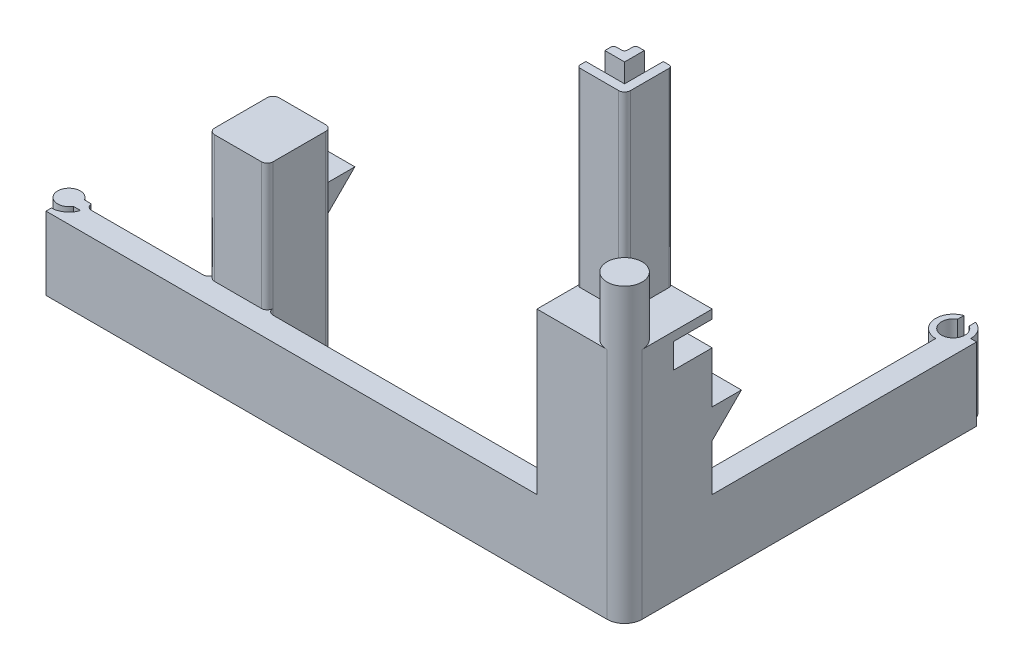
from build123d import *
from build123d.topology import SkipClean

# Parameters (mm, degrees)
SKETCH1_W                 = 30
SKETCH1_H                 = 30
BOSS_EXTRUDE1_DEPTH       = 80
SKETCH2_R                 = 6
BOSS_EXTRUDE2_DEPTH       = 20
CUT_EXTRUDE1_DEPTH        = 83.764726786
BOSS_EXTRUDE3_DEPTH       = 65
BOSS_EXTRUDE5_DEPTH       = 2
BOSS_EXTRUDE6_DEPTH       = 23
BOSS_EXTRUDE7_DEPTH       = 25
FILLET1_R                 = 2
SKETCH11_R                = 6.055782361
CUT_EXTRUDE2_DEPTH        = 2.125
CUT_EXTRUDE3_DEPTH        = 273.546239196
CUT_EXTRUDE3_DEPTH_BACK   = 273.546239196
SKETCH12_W                = 13.25
SKETCH12_H                = 8.5
FILLET2_R                 = 2
CUT_EXTRUDE4_REACH        = 233.991
SKETCH15_W                = 3.75
SKETCH15_H                = 3.75
FILLET3_R                 = 1
BOSS_EXTRUDE8_REACH       = 263.62
SKETCH16_W                = 20
SKETCH16_H                = 22
FILLET4_R                 = 2
FILLET5_R                 = 2
SKETCH17_W                = 15
SKETCH17_H                = 17
CUT_EXTRUDE5_DEPTH        = 66
CHAMFER1_SIZE             = 7
BOSS_EXTRUDE9_DEPTH       = 30
BOSS_EXTRUDE10_DEPTH      = 7.999995
BOSS_EXTRUDE10_DEPTH_BACK = 8.000005


with BuildPart() as part:
    # Sketch1 → Boss-Extrude1 (new body)
    with BuildSketch(Plane(origin=(0, 0, 0), x_dir=(1, 0, 0), z_dir=(0, 1, 0))):
        Rectangle(SKETCH1_W, SKETCH1_H)
    extrude(amount=BOSS_EXTRUDE1_DEPTH)

    # Sketch2 → Boss-Extrude2 (add)
    with BuildSketch(Plane(origin=(0, 80, 0), x_dir=(1, 0, 0), z_dir=(0, 1, 0))):
        with Locations(Location((9, -9, 0), (0, 0, 270))):
            Circle(SKETCH2_R)
    extrude(amount=BOSS_EXTRUDE2_DEPTH)

    # Sketch3 → Cut-Extrude1 (cut, through all)
    with BuildSketch(Plane(origin=(0, 80, 0), x_dir=(1, 0, 0), z_dir=(0, 1, 0))):
        with BuildLine():
            Line((9, -15), (15, -15))
            Line((15, -15), (15, -9))
            ThreePointArc((15, -9), (13.242640687, -13.242640687), (9, -15))
        make_face()
    extrude(amount=-CUT_EXTRUDE1_DEPTH, mode=Mode.SUBTRACT)

    # Sketch4 → Boss-Extrude3 (add)
    with BuildSketch(Plane(origin=(0, 80, 0), x_dir=(1, 0, 0), z_dir=(0, 1, 0))):
        Polygon((1.25, 11.25), (1.25, 15), (-1.75, 15), (-1.75, 11.25), (-1.75, 1.75), (-11.25, 1.75), (-15, 1.75), (-15, -1.25), (-11.25, -1.25), (1.25, -1.25), align=None)
        Polygon((-8.25, 11.25), (-8.25, 8.25), (-11.25, 8.25), (-15, 8.25), (-15, 11.25), (-11.25, 11.25), (-11.25, 15), (-8.25, 15), align=None)
    extrude(amount=BOSS_EXTRUDE3_DEPTH)

    # Sketch6 → Boss-Extrude5 (add)
    with BuildSketch(Plane.XZ):
        with BuildLine():
            Line((15, -15), (7, -15))
            Line((7, -15), (7, -99.5))
            ThreePointArc((7, -99.5), (2.757359313, -109.742640687), (13, -105.5))
            Line((13, -105.5), (15, -105.5))
            Line((15, -105.5), (15, -15))
        make_face()
    extrude(amount=-BOSS_EXTRUDE5_DEPTH)

    # Sketch7 → Boss-Extrude6 (add)
    with SkipClean():  # the faces are left unmerged after this step: merging them gives an invalid solid
        with BuildSketch(Plane(origin=(0, 2, 0), x_dir=(1, 0, 0), z_dir=(0, 1, 0))):
            with BuildLine():
                Line((9, 111.156854249), (9, 108.964101615))
                ThreePointArc((9, 108.964101615), (7, 101.5), (5, 108.964101615))
                Line((5, 108.964101615), (5, 111.156854249))
                ThreePointArc((5, 111.156854249), (1.086408642, 104.485388128), (7, 99.5))
                Line((7, 99.5), (7, 15))
                Line((7, 15), (15, 15))
                Line((15, 15), (15, 105.5))
                Line((15, 105.5), (13, 105.5))
                ThreePointArc((13, 105.5), (11.898979486, 108.964101615), (9, 111.156854249))
            make_face()
        extrude(amount=BOSS_EXTRUDE6_DEPTH)

    # Sketch9 → Boss-Extrude7 (add)
    with SkipClean():  # the faces are left unmerged after this step: merging them gives an invalid solid
        with BuildSketch(Plane.XZ):
            with BuildLine():
                Line((-15, 15), (-15, 7))
                Line((-15, 7), (-177.175, 7))
                ThreePointArc((-177.175, 7), (-177.252697751, 6.037536458), (-177.48377869, 5.1))
                Line((-177.48377869, 5.1), (-179.797778509, 5.1))
                ThreePointArc((-179.797778509, 5.1), (-187.05, 7), (-179.797778509, 8.9))
                Line((-179.797778509, 8.9), (-177.3, 8.9))
                ThreePointArc((-177.3, 8.9), (-179.491885554, 11.955834237), (-183.050001601, 13.173329766))
                Line((-183.050001601, 13.173329766), (-183.050001601, 15))
                Line((-183.050001601, 15), (-15, 15))
            make_face()
        extrude(amount=-BOSS_EXTRUDE7_DEPTH)

    # Fillet1
    fillet1_edges = [part.edges().sort_by_distance(p)[0] for p in [
        (-177.175, 12.5, 7),
    ]]
    fillet(fillet1_edges, radius=FILLET1_R)

    # Sketch11 → Cut-Extrude2 (cut)
    with SkipClean():  # the faces are left unmerged after this step: merging them gives an invalid solid
        with BuildSketch(Plane.XZ):
            with Locations((-183.175, 7)):
                Circle(SKETCH11_R)
        extrude(amount=-CUT_EXTRUDE2_DEPTH, mode=Mode.SUBTRACT)

    # Sketch12 → Cut-Extrude3 (cut, two sides: drawn at the far end of the back side and taken through both)
    with SkipClean():  # the faces are left unmerged after this step: merging them gives an invalid solid
        with BuildSketch(Plane(origin=(15, 0, 0), x_dir=(0, 0, -1), z_dir=(1, 0, 0)).offset(-CUT_EXTRUDE3_DEPTH_BACK)):
            with Locations((8.375, 72.75)):
                Rectangle(SKETCH12_W, SKETCH12_H)
        extrude(amount=CUT_EXTRUDE3_DEPTH + CUT_EXTRUDE3_DEPTH_BACK, mode=Mode.SUBTRACT)

    # Fillet2
    fillet2_edges = [part.edges().sort_by_distance(p)[0] for p in [
        (1.25, 112.5, 1.25),
    ]]
    fillet(fillet2_edges, radius=FILLET2_R)

    # Sketch15 → Cut-Extrude4 (cut, up to next)
    with BuildSketch(Plane(origin=(0, 80, 0), x_dir=(1, 0, 0), z_dir=(0, 1, 0)), mode=Mode.PRIVATE) as cut_extrude4_sk1:
        with Locations((-13.125, 13.125)):
            Rectangle(SKETCH15_W, SKETCH15_H)
    cut_extrude4_tool1 = extrude(cut_extrude4_sk1.sketch, amount=-CUT_EXTRUDE4_REACH, mode=Mode.PRIVATE) & part.part
    add(cut_extrude4_tool1.solids().sort_by_distance((-13.125, 80, -13.125))[0], mode=Mode.SUBTRACT)

    # Fillet3
    fillet3_edges = [part.edges().sort_by_distance(p)[0] for p in [
        (-11.25, 112.5, -15),
        (-11.25, 112.5, -11.25),
        (-15, 112.5, -11.25),
        (-15, 112.5, 1.25),
        (1.25, 112.5, -15),
    ]]
    fillet(fillet3_edges, radius=FILLET3_R)

    # Boss-Extrude8: up to this face of the body (flat: up to its plane)
    boss_extrude8_end = Plane(part.part.faces().sort_by_distance((0, 68.5, -8.375))[0])
    # Sketch16 → Boss-Extrude8 (add, up to the picked face)
    with BuildSketch(Plane.XZ, mode=Mode.PRIVATE) as boss_extrude8_sk1:
        with Locations((-125.321774981, -4)):
            Rectangle(SKETCH16_W, SKETCH16_H)
    boss_extrude8_tool1 = split(extrude(boss_extrude8_sk1.sketch, amount=-BOSS_EXTRUDE8_REACH, mode=Mode.PRIVATE), bisect_by=boss_extrude8_end, keep=Keep.BOTH, mode=Mode.PRIVATE)
    add(boss_extrude8_tool1.solids().sort_by(Axis((-125.321775, 0, -4), (0, 1, 0)))[0])

    # Fillet4
    fillet4_edges = [part.edges().sort_by_distance(p)[0] for p in [
        (-115.321774981, 12.5, 7),
        (-115.321774981, 34.25, -15),
        (-135.321774981, 34.25, -15),
        (-135.321774981, 12.5, 7),
    ]]
    fillet(fillet4_edges, radius=FILLET4_R)

    # Fillet5
    fillet5_edges = [part.edges().sort_by_distance(p)[0] for p in [
        (-115.321774981, 46.75, 7),
        (-135.321774981, 46.75, 7),
    ]]
    fillet(fillet5_edges, radius=FILLET5_R)

    # Sketch17 → Cut-Extrude5 (cut)
    with SkipClean():  # the faces are left unmerged after this step: merging them gives an invalid solid
        with BuildSketch(Plane.XZ):
            with Locations((-125.321774981, -4)):
                Rectangle(SKETCH17_W, SKETCH17_H)
        extrude(amount=-CUT_EXTRUDE5_DEPTH, mode=Mode.SUBTRACT)

    # Chamfer1
    chamfer1_edges = [part.edges().sort_by_distance(p)[0] for p in [
        (-132.821774981, 66, -4),
        (-125.321774981, 66, 4.5),
        (-117.821774981, 66, -4),
        (-125.321774981, 66, -12.5),
    ]]
    chamfer(chamfer1_edges, length=CHAMFER1_SIZE)

    # Sketch18 → Boss-Extrude9 (add)
    with SkipClean():  # the faces are left unmerged after this step: merging them gives an invalid solid
        with BuildSketch(Plane(origin=(15, 0, 0), x_dir=(0, 0, -1), z_dir=(1, 0, 0))):
            Polygon((15, 51), (15, 41), (25, 51), align=None)
        extrude(amount=-BOSS_EXTRUDE9_DEPTH)

    # Sketch19 → Boss-Extrude10 (add, two sides: drawn at the far end of the back side and taken through both)
    with SkipClean():  # the faces are left unmerged after this step: merging them gives an invalid solid
        with BuildSketch(Plane.ZY.offset(125.321774981).offset(-BOSS_EXTRUDE10_DEPTH_BACK)):
            Polygon((-15, 41), (-15, 51), (-25, 51), align=None)
        extrude(amount=BOSS_EXTRUDE10_DEPTH + BOSS_EXTRUDE10_DEPTH_BACK)


solid = part.part
